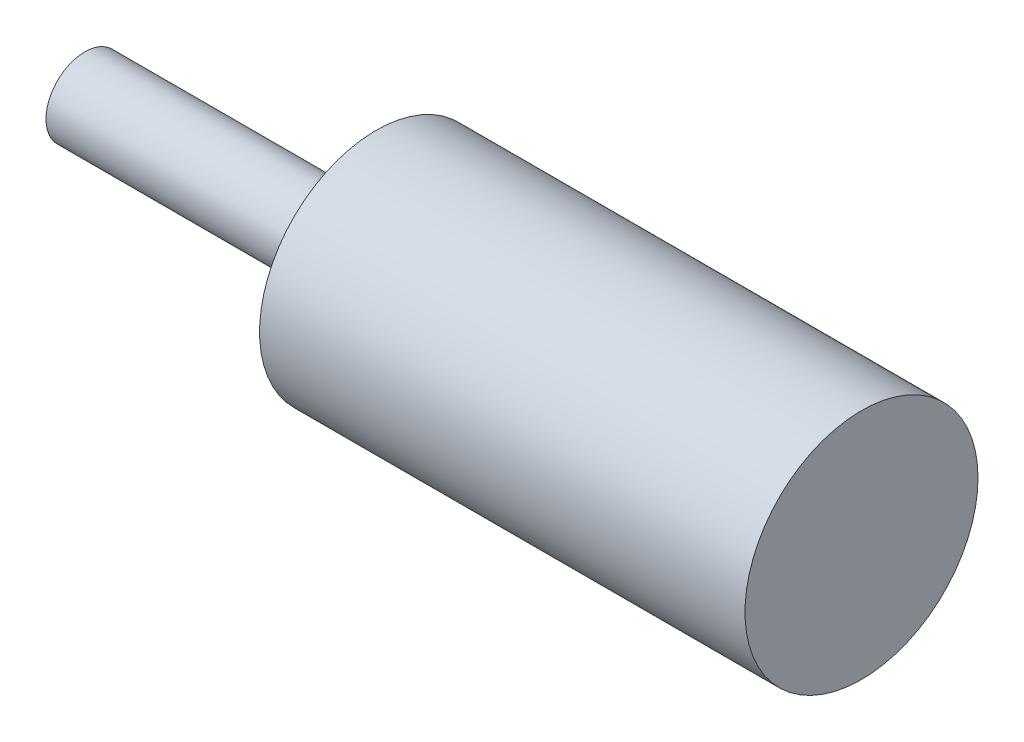
from build123d import *

# Parameters (mm, degrees)
SKETCH1_R           = 6
BOSS_EXTRUDE1_DEPTH = 25
SKETCH2_R           = 2
BOSS_EXTRUDE2_DEPTH = 15
FILLET1_R           = 1


with BuildPart() as part:
    # Sketch1 → Boss-Extrude1 (new body)
    with BuildSketch(Plane(origin=(0, 0, 0), x_dir=(0, 0, -1), z_dir=(1, 0, 0))):
        Circle(SKETCH1_R)
    extrude(amount=BOSS_EXTRUDE1_DEPTH)

    # Sketch2 → Boss-Extrude2 (add)
    with BuildSketch(Plane.ZY):
        with Locations(Location((0, 0, 0), (0, 0, 180))):
            Circle(SKETCH2_R)
    extrude(amount=BOSS_EXTRUDE2_DEPTH)

    # Fillet1
    fillet1_edges = [part.edges().sort_by_distance(p)[0] for p in [
        (0, 0, 2),
    ]]
    fillet(fillet1_edges, radius=FILLET1_R)


solid = part.part
